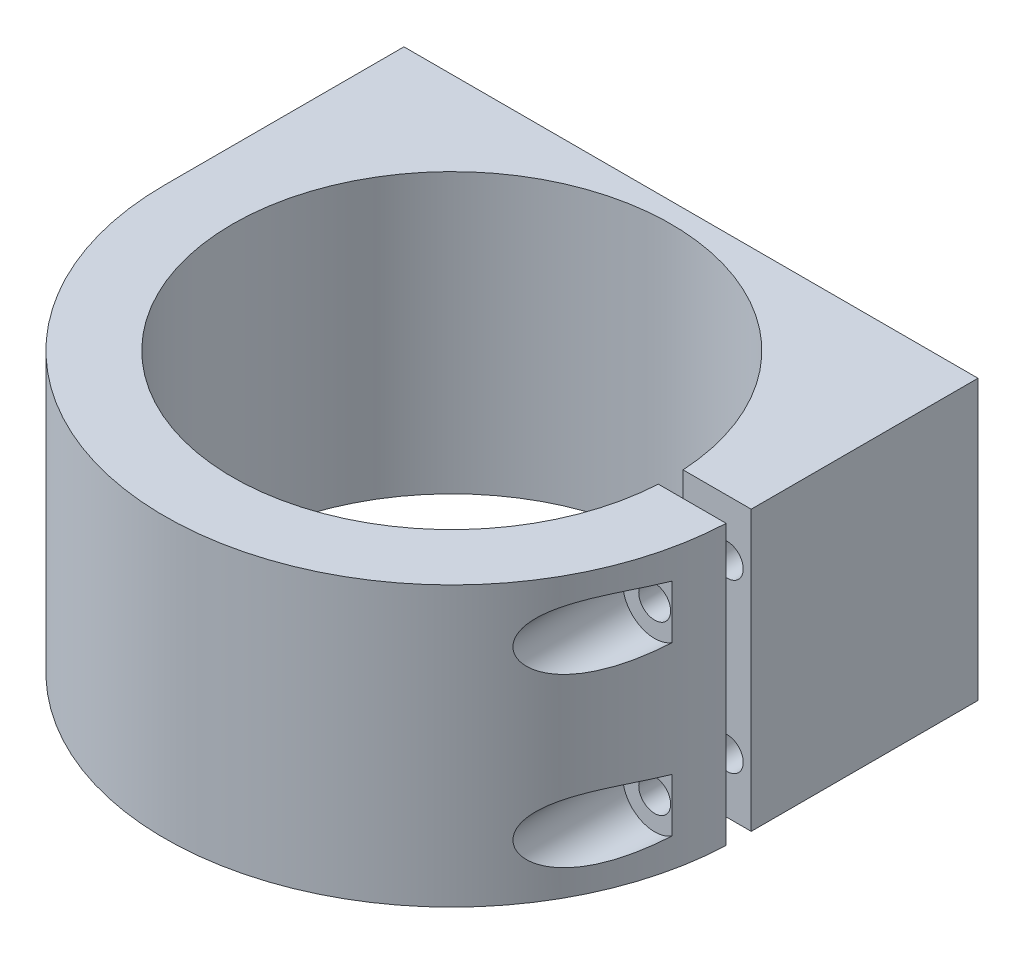
from build123d import *

# Parameters (mm, degrees)
BOSS_EXTRUDE1_DEPTH = 35
SKETCH2_R           = 2
CUT_EXTRUDE1_DEPTH  = 83.927679336
CUT_EXTRUDE2_REACH  = 64.699
SKETCH3_R           = 4


with BuildPart() as part:
    # Sketch1 → Boss-Extrude1 (new body)
    with BuildSketch(Plane(origin=(0, 0, 0), x_dir=(1, 0, 0), z_dir=(0, 1, 0))):
        with BuildLine():
            Line((-36, 30), (-36, 0))
            ThreePointArc((-36, 0), (-0.776670285, -35.991621015), (35.966487959, -1.552979031))
            Line((35.966487959, -1.552979031), (27.456115095, -1.552979031))
            ThreePointArc((27.456115095, -1.552979031), (-27.5, 0), (27.456115095, 1.552979031))
            Line((27.456115095, 1.552979031), (36, 1.552979031))
            Line((36, 1.552979031), (36, 30))
            Line((36, 30), (-36, 30))
        make_face()
    extrude(amount=BOSS_EXTRUDE1_DEPTH)

    # Sketch2 → Cut-Extrude1 (cut, through all)
    with BuildSketch(Plane(origin=(0, 0, -30), x_dir=(-1, 0, 0), z_dir=(0, 0, -1))):
        with Locations((-33, 28)):
            Circle(SKETCH2_R)
        with Locations((33, 28)):
            Circle(SKETCH2_R)
        with Locations((33, 7)):
            Circle(SKETCH2_R)
        with Locations((-33, 7)):
            Circle(SKETCH2_R)
    extrude(amount=-CUT_EXTRUDE1_DEPTH, mode=Mode.SUBTRACT)

    # Sketch3 → Cut-Extrude2 (cut, up to next)
    with BuildSketch(Plane(origin=(0, 0, 7.552979031), x_dir=(-1, 0, 0), z_dir=(0, 0, -1)), mode=Mode.PRIVATE) as cut_extrude2_sk1:
        with Locations((-33, 28)):
            Circle(SKETCH3_R)
    cut_extrude2_tool1 = extrude(cut_extrude2_sk1.sketch, amount=-CUT_EXTRUDE2_REACH, mode=Mode.PRIVATE) & part.part
    # Sketch3 → Cut-Extrude2 (cut, up to next)
    with BuildSketch(Plane(origin=(0, 0, 7.552979031), x_dir=(-1, 0, 0), z_dir=(0, 0, -1)), mode=Mode.PRIVATE) as cut_extrude2_sk2:
        with Locations((-33, 7)):
            Circle(SKETCH3_R)
    cut_extrude2_tool2 = extrude(cut_extrude2_sk2.sketch, amount=-CUT_EXTRUDE2_REACH, mode=Mode.PRIVATE) & part.part
    # Sketch3 → Cut-Extrude2 (cut, up to next)
    with BuildSketch(Plane(origin=(0, 0, 7.552979031), x_dir=(-1, 0, 0), z_dir=(0, 0, -1)), mode=Mode.PRIVATE) as cut_extrude2_sk3:
        with Locations((33, 28)):
            Circle(SKETCH3_R)
    cut_extrude2_tool3 = extrude(cut_extrude2_sk3.sketch, amount=-CUT_EXTRUDE2_REACH, mode=Mode.PRIVATE) & part.part
    # Sketch3 → Cut-Extrude2 (cut, up to next)
    with BuildSketch(Plane(origin=(0, 0, 7.552979031), x_dir=(-1, 0, 0), z_dir=(0, 0, -1)), mode=Mode.PRIVATE) as cut_extrude2_sk4:
        with Locations((33, 7)):
            Circle(SKETCH3_R)
    cut_extrude2_tool4 = extrude(cut_extrude2_sk4.sketch, amount=-CUT_EXTRUDE2_REACH, mode=Mode.PRIVATE) & part.part
    add(cut_extrude2_tool1.solids().sort_by_distance((33, 28, 7.552979))[0], mode=Mode.SUBTRACT)
    add(cut_extrude2_tool2.solids().sort_by_distance((33, 7, 7.552979))[0], mode=Mode.SUBTRACT)
    add(cut_extrude2_tool3.solids().sort_by_distance((-33, 28, 7.552979))[0], mode=Mode.SUBTRACT)
    add(cut_extrude2_tool4.solids().sort_by_distance((-33, 7, 7.552979))[0], mode=Mode.SUBTRACT)


solid = part.part
